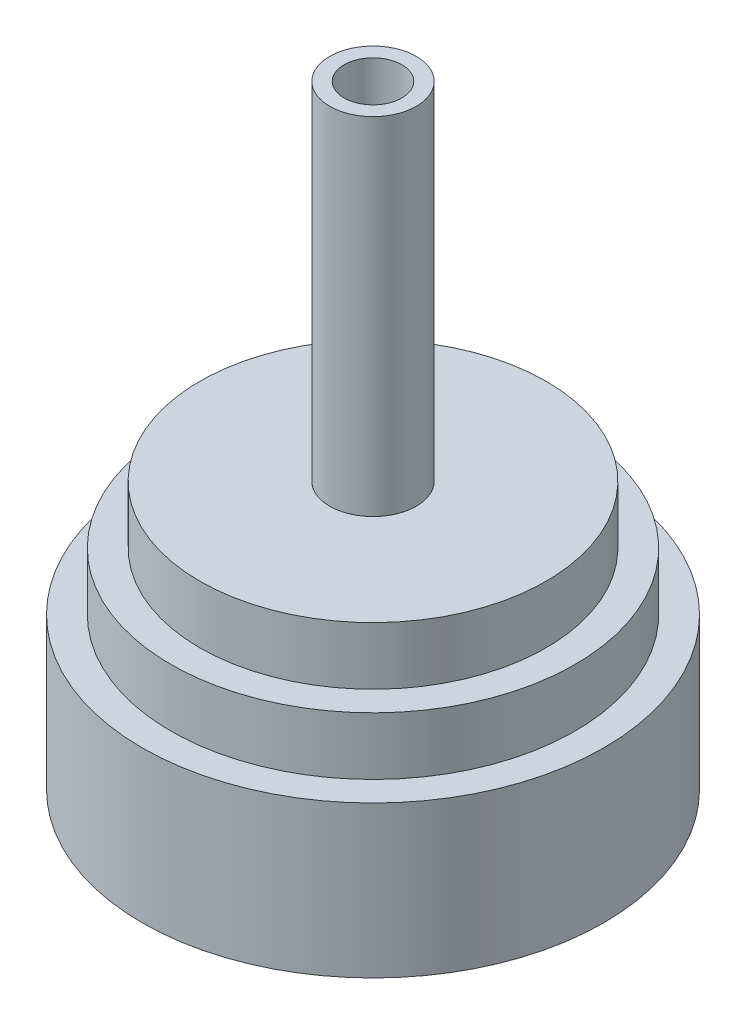
from build123d import *

# Parameters (mm, degrees)
SKETCH3_R           = 7.5
SKETCH3_R_2         = 5
BOSS_EXTRUDE1_DEPTH = 60


with BuildPart() as part:
    # Sketch3 → Boss-Extrude1 (new body)
    with BuildSketch(Plane(origin=(0, 0, 0), x_dir=(1, 0, 0), z_dir=(0, 1, 0))):
        with Locations(Location((0, 0, 0), (0, 0, 270))):
            Circle(SKETCH3_R)
        with Locations(Location((0, 0, 0), (0, 0, 270))):
            Circle(SKETCH3_R_2, mode=Mode.SUBTRACT)
    extrude(amount=BOSS_EXTRUDE1_DEPTH)


with BuildPart() as body_2:
    # Sketch4 → Revolve1 (revolve)
    with BuildSketch(Plane(origin=(0, 0, 0), x_dir=(0, 0, -1), z_dir=(1, 0, 0))):
        Polygon((7.5, 0), (30, 0), (30, -10), (35, -10), (35, -20), (40, -20), (40, -46.248693519), (30, -40), (30, -15), (7.5, -15), align=None)
    revolve(axis=Axis((0, 0, 0), (0, 1, 0)))


solid = Compound([part.part, body_2.part])
